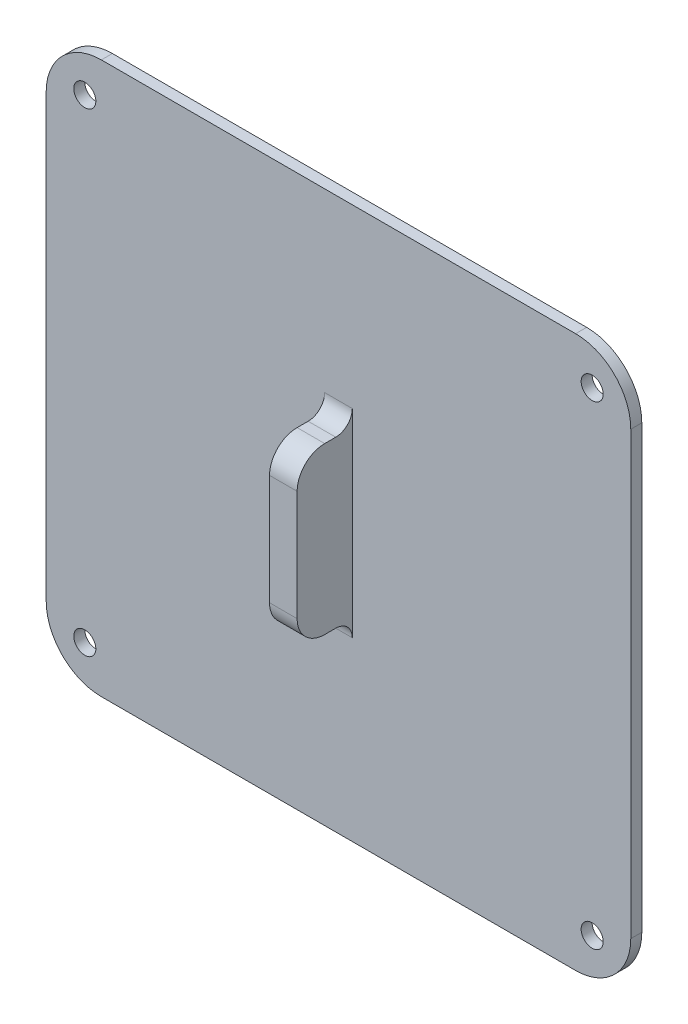
from build123d import *

# Parameters (mm, degrees)
BOSS_EXTRUDE1_DEPTH = 2
SKETCH2_R           = 2
CUT_EXTRUDE1_DEPTH  = 3
SKETCH6_W           = 5
SKETCH6_H           = 30
BOSS_EXTRUDE2_DEPTH = 10
FILLET1_R           = 5
FILLET2_R           = 3


with BuildPart() as part:
    # Sketch1 → Boss-Extrude1 (new body)
    with BuildSketch(Plane.XY):
        with BuildLine():
            Line((-43, 260), (43, 260))
            ThreePointArc((43, 260), (50.071067812, 262.928932188), (53, 270))
            Line((53, 270), (53, 350))
            ThreePointArc((53, 350), (50.071067812, 357.071067812), (43, 360))
            Line((43, 360), (-43, 360))
            ThreePointArc((-43, 360), (-50.071067812, 357.071067812), (-53, 350))
            Line((-53, 350), (-53, 270))
            ThreePointArc((-53, 270), (-50.071067812, 262.928932188), (-43, 260))
        make_face()
    extrude(amount=-BOSS_EXTRUDE1_DEPTH)

    # Sketch2 → Cut-Extrude1 (cut)
    with BuildSketch(Plane(origin=(0, 0, -2), x_dir=(-1, 0, 0), z_dir=(0, 0, -1))):
        with Locations((46, 267)):
            Circle(SKETCH2_R)
        with Locations((-46, 267)):
            Circle(SKETCH2_R)
        with Locations(Location((-46, 353, 0), (0, 0, 180))):
            Circle(SKETCH2_R)
        with Locations(Location((46, 353, 0), (0, 0, 180))):
            Circle(SKETCH2_R)
    extrude(amount=-CUT_EXTRUDE1_DEPTH, mode=Mode.SUBTRACT)

    # Sketch6 → Boss-Extrude2 (add)
    with BuildSketch(Plane.XY):
        with Locations((0, 310)):
            Rectangle(SKETCH6_W, SKETCH6_H)
    extrude(amount=BOSS_EXTRUDE2_DEPTH)

    # Fillet1
    fillet1_edges = [part.edges().sort_by_distance(p)[0] for p in [
        (0, 295, 10),
        (0, 325, 10),
    ]]
    fillet(fillet1_edges, radius=FILLET1_R)

    # Fillet2
    fillet2_edges = [part.edges().sort_by_distance(p)[0] for p in [
        (0, 295, 0),
        (0, 325, 0),
    ]]
    fillet(fillet2_edges, radius=FILLET2_R)


solid = part.part
